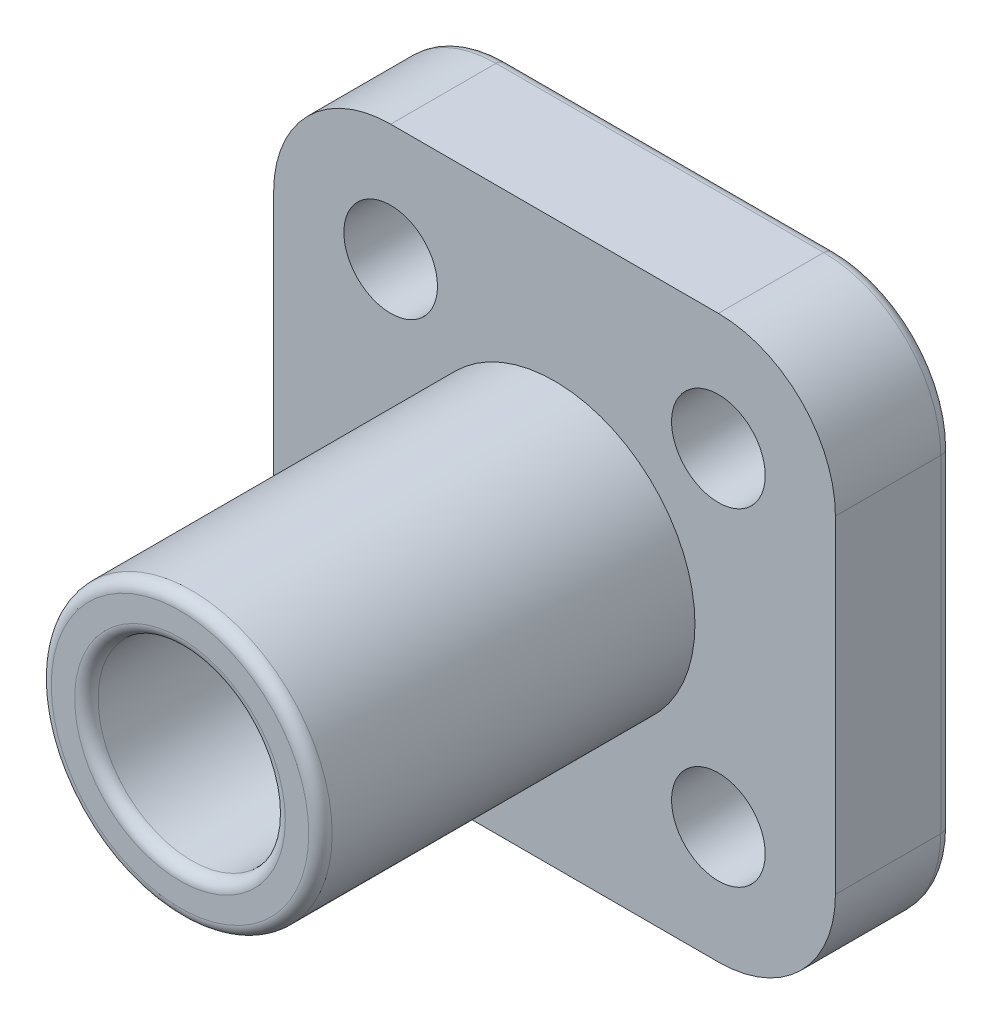
from build123d import *

# Parameters (mm, degrees)
ESQUISSE1_R             = 2
BOSS_EXTRU_1_DEPTH      = 5
ESQUISSE2_R             = 6
ESQUISSE2_R_2           = 4
BOSS_EXTRU_2_DEPTH      = 16
ENL_V_MAT_EXTRU_1_REACH = 25.324
ESQUISSE3_R             = 4
CONG_1_R                = 0.5


with BuildPart() as part:
    # Esquisse1 → Boss.-Extru.1 (new body)
    with BuildSketch(Plane.XY):
        with BuildLine():
            Line((7, -12), (-7, -12))
            ThreePointArc((-7, -12), (-10.535533906, -10.535533906), (-12, -7))
            Line((-12, -7), (-12, 7))
            ThreePointArc((-12, 7), (-10.535533906, 10.535533906), (-7, 12))
            Line((-7, 12), (7, 12))
            ThreePointArc((7, 12), (10.535533906, 10.535533906), (12, 7))
            Line((12, 7), (12, -7))
            ThreePointArc((12, -7), (10.535533906, -10.535533906), (7, -12))
        make_face()
        with Locations((-7, 7)):
            Circle(ESQUISSE1_R, mode=Mode.SUBTRACT)
        with Locations((7, 7)):
            Circle(ESQUISSE1_R, mode=Mode.SUBTRACT)
        with Locations((7, -7)):
            Circle(ESQUISSE1_R, mode=Mode.SUBTRACT)
        with Locations((-7, -7)):
            Circle(ESQUISSE1_R, mode=Mode.SUBTRACT)
    extrude(amount=BOSS_EXTRU_1_DEPTH)

    # Esquisse2 → Boss.-Extru.2 (add)
    with BuildSketch(Plane.XY.offset(5)):
        Circle(ESQUISSE2_R)
        Circle(ESQUISSE2_R_2, mode=Mode.SUBTRACT)
    extrude(amount=BOSS_EXTRU_2_DEPTH)

    # Esquisse3 → Enlèv. mat.-Extru.1 (cut, up to next)
    with BuildSketch(Plane.XY.offset(5), mode=Mode.PRIVATE) as enl_v_mat_extru_1_sk1:
        Circle(ESQUISSE3_R)
    enl_v_mat_extru_1_tool1 = extrude(enl_v_mat_extru_1_sk1.sketch, amount=-ENL_V_MAT_EXTRU_1_REACH, mode=Mode.PRIVATE) & part.part
    add(enl_v_mat_extru_1_tool1.solids().sort_by_distance((0, 0, 5))[0], mode=Mode.SUBTRACT)

    # Congé1
    cong_1_edges = [part.edges().sort_by_distance(p)[0] for p in [
        (0, 12, 0),
        (10.535533906, 10.535533906, 0),
        (12, 0, 0),
        (10.535533906, -10.535533906, 0),
        (-9, 7, 0),
        (5, 7, 0),
        (5, -7, 0),
        (-9, -7, 0),
        (-6, 0, 21),
        (-4, 0, 21),
        (-4, 0, 0),
        (0, -12, 0),
        (-10.535533906, -10.535533906, 0),
        (-12, 0, 0),
        (-10.535533906, 10.535533906, 0),
    ]]
    fillet(cong_1_edges, radius=CONG_1_R)


solid = part.part
